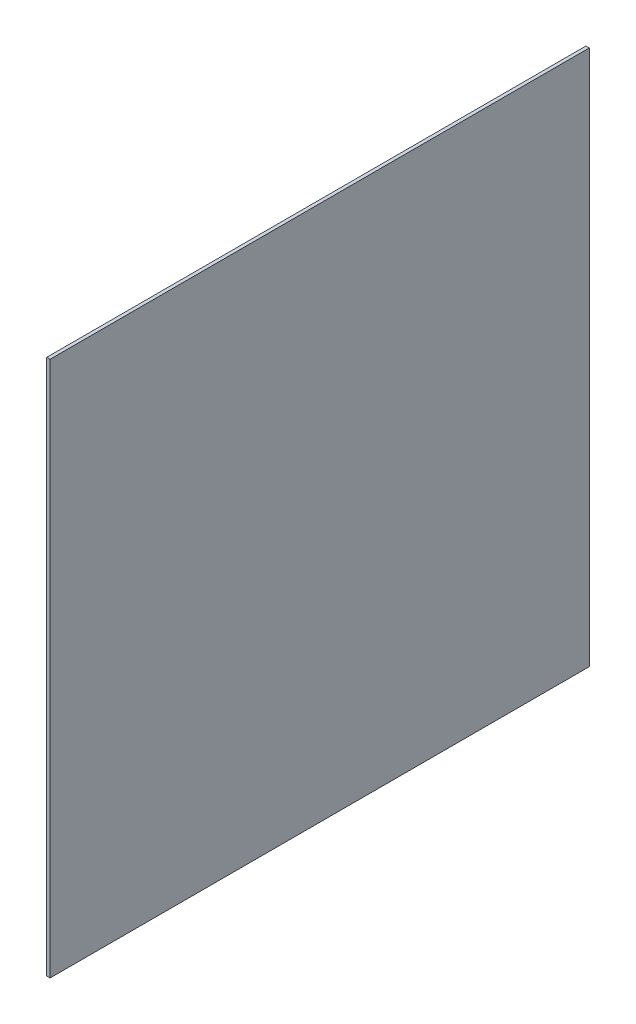
from build123d import *

# Parameters (mm, degrees)
SKETCH1_W           = 511.175
SKETCH1_H           = 508
BOSS_EXTRUDE1_DEPTH = 1.5875


with BuildPart() as part:
    # Sketch1 → Boss-Extrude1 (new, symmetric)
    with BuildSketch(Plane(origin=(0, 0, 0), x_dir=(0, 0, -1), z_dir=(1, 0, 0))):
        Rectangle(SKETCH1_W, SKETCH1_H)
    extrude(amount=BOSS_EXTRUDE1_DEPTH, both=True)


solid = part.part
